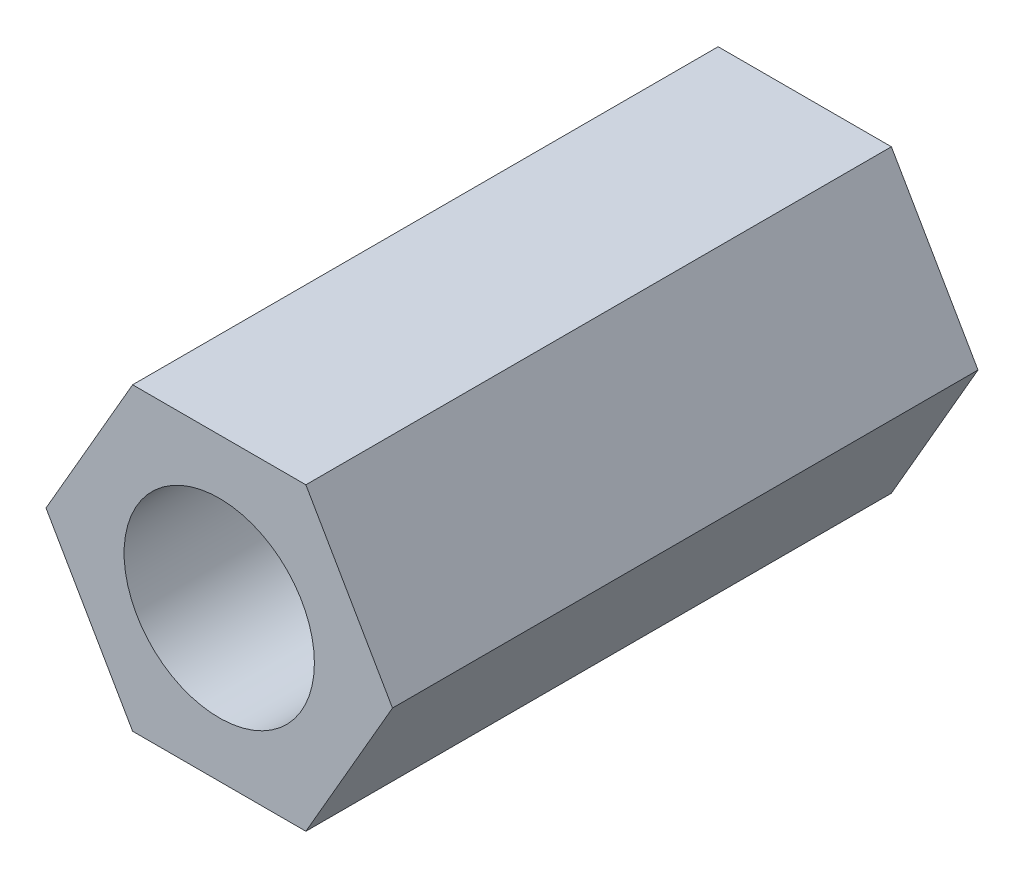
from build123d import *

# Parameters (mm, degrees)
EXTRUDE_1_DEPTH     = 80
SKETCH_2_R          = 13
CUT_EXTRUDE_1_DEPTH = 37
SKETCH_3_R          = 11.1
CUT_EXTRUDE_2_DEPTH = 63


with BuildPart() as part:
    # 草图1 → 凸台-拉伸1 (new body)
    with BuildSketch(Plane.XY):
        Polygon((-23.671361037, 0), (-11.835680518, -20.5), (11.835680518, -20.5), (23.671361037, 0), (11.835680518, 20.5), (-11.835680518, 20.5), align=None)
    extrude(amount=EXTRUDE_1_DEPTH)

    # 草图2 → 切除-拉伸1 (cut)
    with BuildSketch(Plane.XY.offset(80)):
        Circle(SKETCH_2_R)
    extrude(amount=-CUT_EXTRUDE_1_DEPTH, mode=Mode.SUBTRACT)

    # 草图3 → 切除-拉伸2 (cut)
    with BuildSketch(Plane.XY.offset(43)):
        Circle(SKETCH_3_R)
    extrude(amount=-CUT_EXTRUDE_2_DEPTH, mode=Mode.SUBTRACT)


solid = part.part
